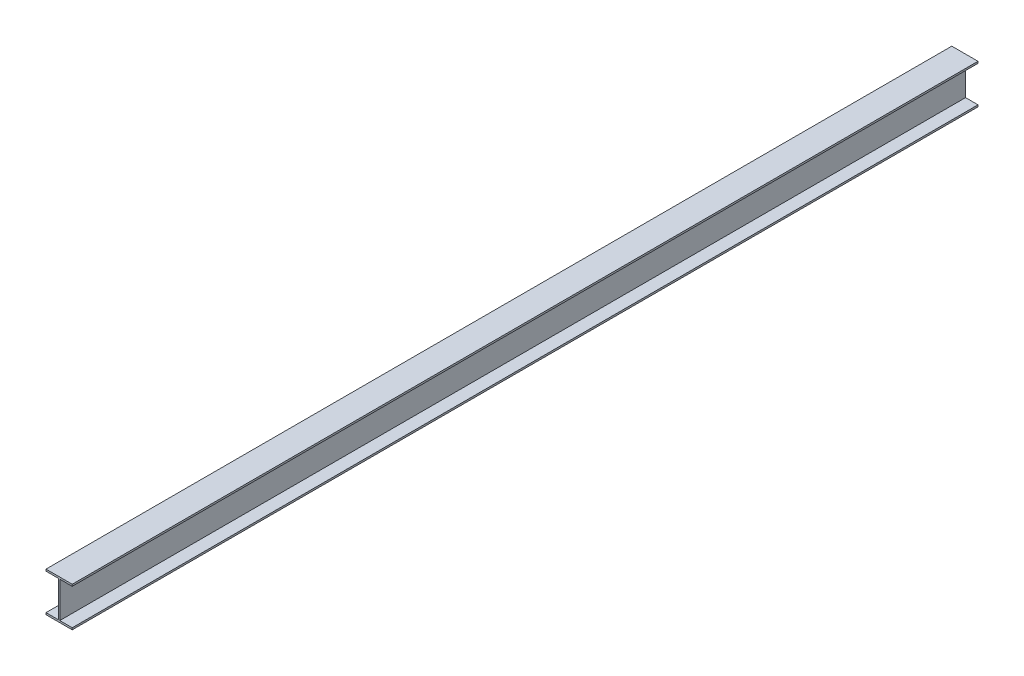
from build123d import *

# Parameters (mm, degrees)
BOSS_EXTRUDE1_DEPTH = 3510


with BuildPart() as part:
    # Sketch1 → Boss-Extrude1 (new body)
    with BuildSketch(Plane.XY):
        Polygon((0, -0.000240533), (101.6, -0.000240533), (101.6, -7.112240533), (53.408035714, -7.112240533), (53.408035714, -146.050240533), (101.6, -146.050240533), (101.6, -153.162240533), (0, -153.162240533), (0, -146.050240533), (47.566035714, -146.050240533), (47.566035714, -7.112240533), (0, -7.112240533), align=None)
    extrude(amount=BOSS_EXTRUDE1_DEPTH)


solid = part.part
